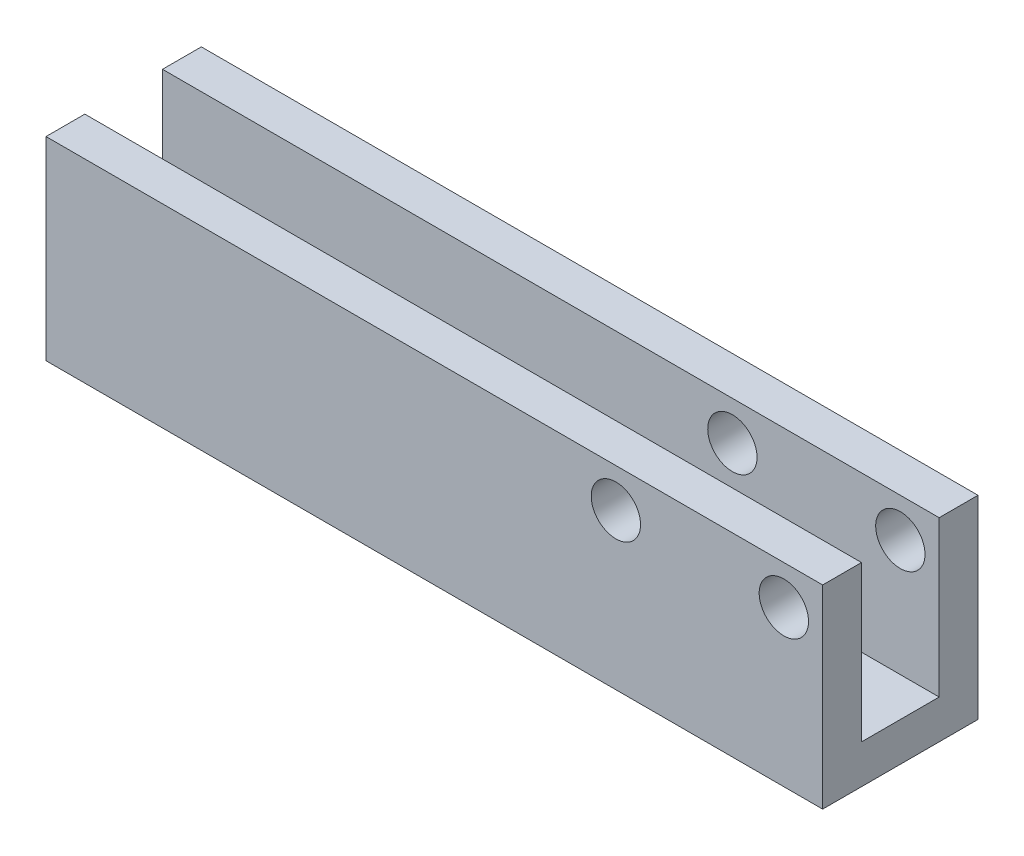
from build123d import *

# Parameters (mm, degrees)
SKETCH1_W           = 200
SKETCH1_H           = 50
BOSS_EXTRUDE1_DEPTH = 40
SKETCH2_R           = 6.35
CUT_EXTRUDE1_DEPTH  = 111.566721937
SKETCH4_W           = 20
SKETCH4_H           = 40
CUT_EXTRUDE2_DEPTH  = 206.48722588


with BuildPart() as part:
    # Sketch1 → Boss-Extrude1 (new body)
    with BuildSketch(Plane.XY):
        Rectangle(SKETCH1_W, SKETCH1_H)
    extrude(amount=BOSS_EXTRUDE1_DEPTH)

    # Sketch2 → Cut-Extrude1 (cut, through all)
    with BuildSketch(Plane.XY.offset(40)):
        with Locations((90, 15)):
            Circle(SKETCH2_R)
        with Locations((46.75, 15)):
            Circle(SKETCH2_R)
    extrude(amount=-CUT_EXTRUDE1_DEPTH, mode=Mode.SUBTRACT)

    # Sketch4 → Cut-Extrude2 (cut, through all)
    with BuildSketch(Plane.ZY.offset(100)):
        with Locations((20, 5)):
            Rectangle(SKETCH4_W, SKETCH4_H)
    extrude(amount=-CUT_EXTRUDE2_DEPTH, mode=Mode.SUBTRACT)


solid = part.part
